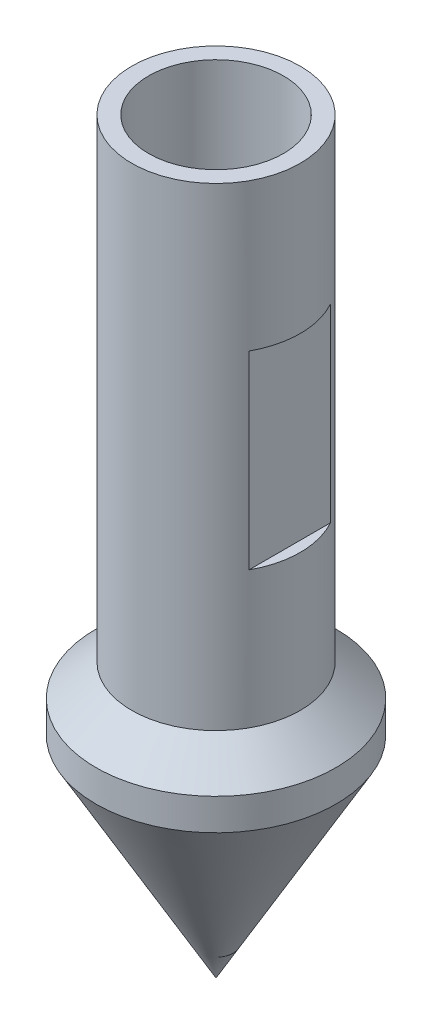
from build123d import *

# Parameters (mm, degrees)
SKETCH2_R               = 3.2
CUT_EXTRUDE1_DEPTH      = 9.5
CUT_EXTRUDE2_DEPTH      = 9.5
CUT_EXTRUDE2_DEPTH_BACK = 9.5
SKETCH3_W               = 4
SKETCH3_H               = 9


with BuildPart() as part:
    # Sketch1 → Revolve1 (revolve)
    with BuildSketch(Plane.XY):
        Polygon((0, -7.607142857), (0, 15.5), (-4, 15.5), (-4, -7), (-5.7, -8.5), (-5.7, -10), (0, -20), align=None)
    revolve(axis=Axis((0, -7.607142857, 0), (0, 1, 0)))

    # Sketch2 → Cut-Extrude1 (cut)
    with BuildSketch(Plane(origin=(0, 15.5, 0), x_dir=(1, 0, 0), z_dir=(0, 1, 0))):
        Circle(SKETCH2_R)
    extrude(amount=-CUT_EXTRUDE1_DEPTH, mode=Mode.SUBTRACT)

    # Sketch3 → Cut-Extrude2 (cut, two sides: drawn at the far end of the back side and taken through both)
    with BuildSketch(Plane.XY.offset(-CUT_EXTRUDE2_DEPTH_BACK)):
        with Locations((-5.5, 4)):
            Rectangle(SKETCH3_W, SKETCH3_H)
        with Locations((5.5, 4)):
            Rectangle(SKETCH3_W, SKETCH3_H)
    extrude(amount=CUT_EXTRUDE2_DEPTH + CUT_EXTRUDE2_DEPTH_BACK, mode=Mode.SUBTRACT)


solid = part.part
